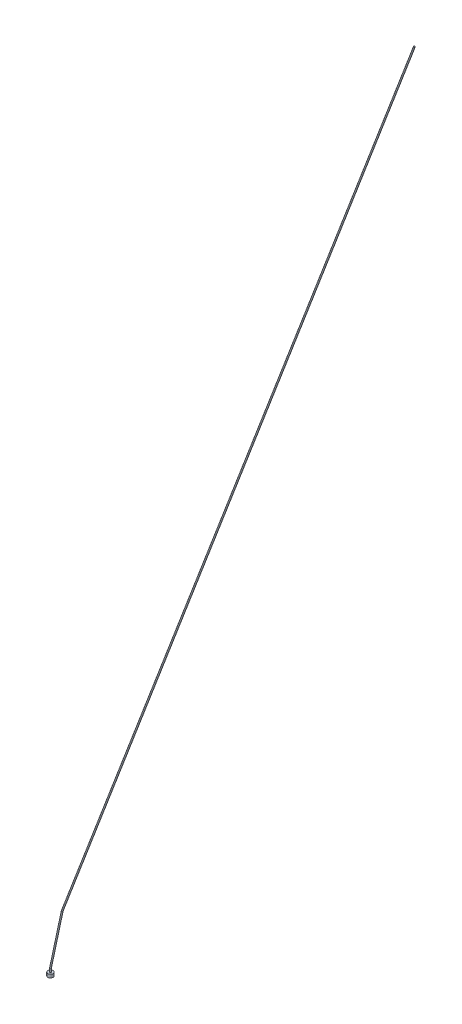
from build123d import *

# Parameters (mm, degrees)
SWEEP1_PROFILE_R    = 1
SKETCH10_R          = 4
BOSS_EXTRUDE1_DEPTH = 5


with BuildPart() as part:
    # Sweep1: sweep along a path in Sketch1
    with BuildLine(Plane.XY) as sweep1_path:
        Line((611.965, 1457.5), (73, 42.5))
        Line((73, 42.5), (55, -42.5))
        Line((55, -42.5), (55, -52.5))
    # Sweep1 profile (on start of the path) → Sweep1 (sweep)
    with BuildSketch(Plane(origin=(611.965, 1457.5, 0), x_dir=(-0.9345058856809988, 0.35594767821629636, 0), z_dir=(-0.35594767821629636, -0.9345058856809988, 0))):
        Circle(SWEEP1_PROFILE_R)
    sweep(path=sweep1_path.line, transition=Transition.RIGHT)

    # Sketch10 → Boss-Extrude1 (add)
    with BuildSketch(Plane.XZ.offset(52.5)):
        with Locations((55, 0)):
            Circle(SKETCH10_R)
    extrude(amount=-BOSS_EXTRUDE1_DEPTH)


solid = part.part
